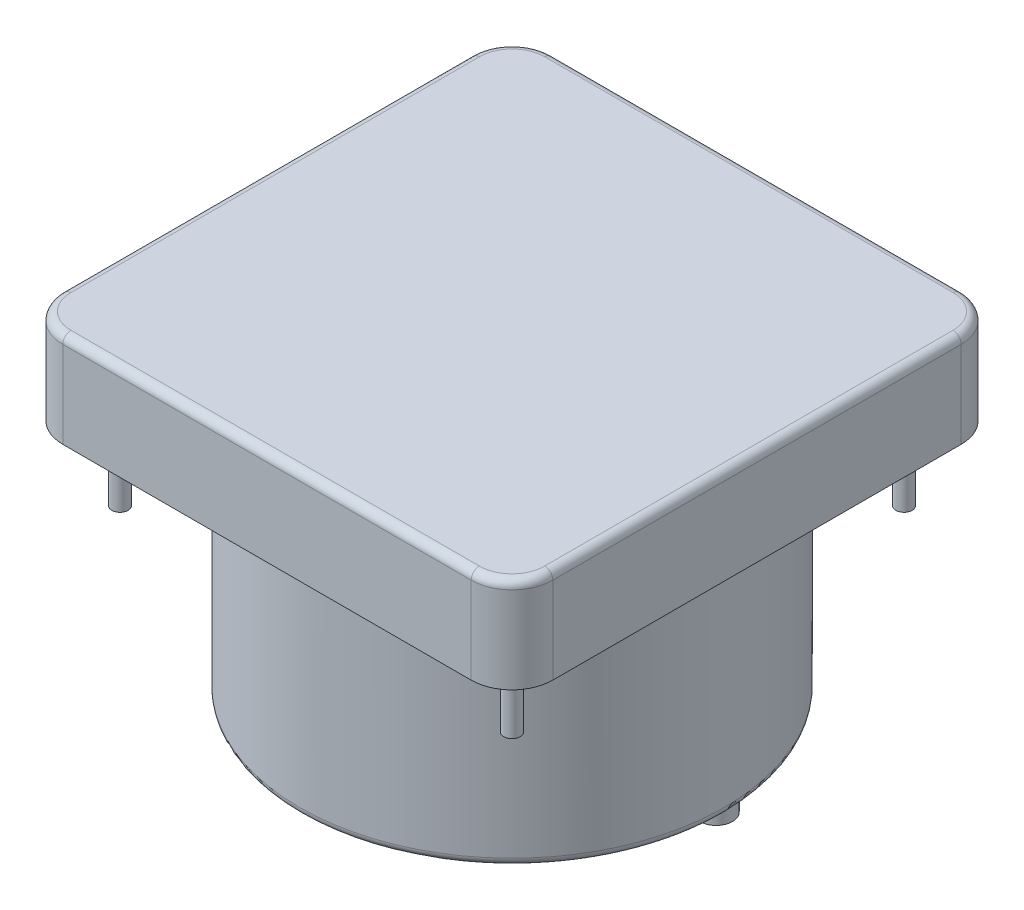
from build123d import *

# Parameters (mm, degrees)
SKETCH1_R           = 26
BOSS_EXTRUDE1_DEPTH = 29
SKETCH2_W           = 60
SKETCH2_H           = 60
BOSS_EXTRUDE2_DEPTH = 11.6
FILLET1_R           = 5
SKETCH5_R           = 2
BOSS_EXTRUDE3_DEPTH = 10
SKETCH6_R           = 1
BOSS_EXTRUDE4_DEPTH = 9
FILLET2_R           = 1
FILLET3_R           = 1
SKETCH7_R           = 5
BOSS_EXTRUDE5_DEPTH = 1


with BuildPart() as part:
    # Sketch1 → Boss-Extrude1 (new body)
    with BuildSketch(Plane(origin=(0, 0, 0), x_dir=(1, 0, 0), z_dir=(0, 1, 0))):
        with Locations(Location((0, 0, 0), (0, 0, 90))):
            Circle(SKETCH1_R)
    extrude(amount=BOSS_EXTRUDE1_DEPTH)

    # Sketch2 → Boss-Extrude2 (add)
    with BuildSketch(Plane(origin=(0, 29, 0), x_dir=(1, 0, 0), z_dir=(0, 1, 0))):
        Rectangle(SKETCH2_W, SKETCH2_H)
    extrude(amount=BOSS_EXTRUDE2_DEPTH)

    # Fillet1
    fillet1_edges = [part.edges().sort_by_distance(p)[0] for p in [
        (30, 34.8, 30),
        (30, 34.8, -30),
        (-30, 34.8, -30),
        (-30, 34.8, 30),
    ]]
    fillet(fillet1_edges, radius=FILLET1_R)

    # Sketch5 → Boss-Extrude3 (add)
    with BuildSketch(Plane.XZ):
        with Locations(Location((15, -10, 0), (0, 0, 90))):
            Circle(SKETCH5_R)
        with Locations(Location((-15, -10, 0), (0, 0, 90))):
            Circle(SKETCH5_R)
    extrude(amount=BOSS_EXTRUDE3_DEPTH)

    # Sketch6 → Boss-Extrude4 (add)
    with BuildSketch(Plane.XZ.offset(-29)):
        with Locations(Location((24, -24, 0), (0, 0, 270))):
            Circle(SKETCH6_R)
        with Locations(Location((24, 24, 0), (0, 0, 90))):
            Circle(SKETCH6_R)
        with Locations(Location((-24, 24, 0), (0, 0, 270))):
            Circle(SKETCH6_R)
        with Locations(Location((-24, -24, 0), (0, 0, 90))):
            Circle(SKETCH6_R)
    extrude(amount=BOSS_EXTRUDE4_DEPTH)

    # Fillet2
    fillet2_edges = [part.edges().sort_by_distance(p)[0] for p in [
        (-30, 40.6, 0),
        (0, 40.6, -30),
        (30, 40.6, 0),
        (0, 40.6, 30),
        (28.535533906, 40.6, 28.535533906),
        (28.535533906, 40.6, -28.535533906),
        (-28.535533906, 40.6, 28.535533906),
        (-28.535533906, 40.6, -28.535533906),
    ]]
    fillet(fillet2_edges, radius=FILLET2_R)

    # Fillet3
    fillet3_edges = [part.edges().sort_by_distance(p)[0] for p in [
        (0, 0, 26),
    ]]
    fillet(fillet3_edges, radius=FILLET3_R)

    # Sketch7 → Boss-Extrude5 (add)
    with BuildSketch(Plane.XZ):
        with Locations(Location((15, -10, 0), (0, 0, 90))):
            Circle(SKETCH7_R)
        with Locations(Location((-15, -10, 0), (0, 0, 90))):
            Circle(SKETCH7_R)
    extrude(amount=BOSS_EXTRUDE5_DEPTH)


solid = part.part
